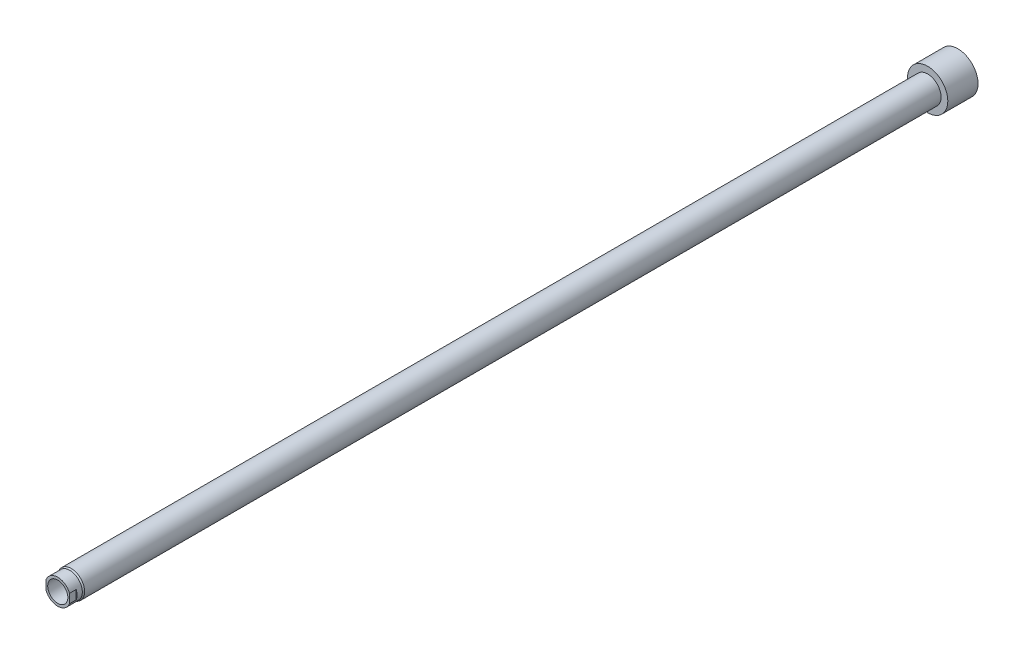
from build123d import *

# Parameters (mm, degrees)
SKETCH1_W           = 19.05
SKETCH1_H           = 28.575
SKETCH2_R           = 12.7
BOSS_EXTRUDE1_DEPTH = 695.325
SKETCH3_R           = 12.7
BOSS_EXTRUDE2_DEPTH = 1.374815329
BOSS_EXTRUDE2_TAPER = 30
SKETCH4_R           = 11.90625
BOSS_EXTRUDE3_DEPTH = 11.325184671
CUT_EXTRUDE1_START  = -6.35
CUT_EXTRUDE1_DEPTH  = 6.35
CUT_EXTRUDE2_START  = -6.35
CUT_EXTRUDE2_DEPTH  = 6.35
SKETCH10_R          = 9.525
CUT_EXTRUDE4_DEPTH  = 28.575
SKETCH8_R           = 19.05
BOSS_EXTRUDE5_DEPTH = 114.3
SKETCH9_R           = 19.05
SKETCH9_R_2         = 12.7
CUT_EXTRUDE3_DEPTH  = 114.3


with BuildPart() as part:
    # Sketch1 → Revolve1 (revolve)
    with BuildSketch(Plane.XZ, mode=Mode.PRIVATE) as revolve1_sk:
        with Locations((9.525, -671.5125)):
            Rectangle(SKETCH1_W, SKETCH1_H)
    revolve(revolve1_sk.sketch.rotate(Axis((0, 0, -657.225), (0, 0, -1)), 180), axis=Axis((0, 0, -657.225), (0, 0, -1)))

    # Sketch2 → Boss-Extrude1 (add)
    with BuildSketch(Plane.XY.offset(-657.225)):
        Circle(SKETCH2_R)
    extrude(amount=BOSS_EXTRUDE1_DEPTH)

    # Sketch3 → Boss-Extrude2 (add)
    with BuildSketch(Plane.XY.offset(38.1)):
        Circle(SKETCH3_R)
    extrude(amount=BOSS_EXTRUDE2_DEPTH, taper=BOSS_EXTRUDE2_TAPER)

    # Sketch4 → Boss-Extrude3 (add)
    with BuildSketch(Plane.XY.offset(39.474815329)):
        Circle(SKETCH4_R)
    extrude(amount=BOSS_EXTRUDE3_DEPTH)

    # Sketch5 → Cut-Extrude1 (cut)
    with BuildSketch(Plane.XY.offset(50.8).offset(CUT_EXTRUDE1_START)):
        with BuildLine():
            Line((11.1125, 4.274474566), (11.1125, -4.274474566))
            ThreePointArc((11.1125, -4.274474566), (11.90625, 0), (11.1125, 4.274474566))
        make_face()
    extrude(amount=CUT_EXTRUDE1_DEPTH, mode=Mode.SUBTRACT)

    # Sketch6 → Cut-Extrude2 (cut)
    with BuildSketch(Plane.XY.offset(50.8).offset(CUT_EXTRUDE2_START)):
        with BuildLine():
            Line((-11.1125, -4.274474566), (-11.1125, 4.274474566))
            ThreePointArc((-11.1125, 4.274474566), (-11.90625, 0), (-11.1125, -4.274474566))
        make_face()
    extrude(amount=CUT_EXTRUDE2_DEPTH, mode=Mode.SUBTRACT)

    # Sketch10 → Cut-Extrude4 (cut)
    with BuildSketch(Plane.XY.offset(50.8)):
        Circle(SKETCH10_R)
    extrude(amount=-CUT_EXTRUDE4_DEPTH, mode=Mode.SUBTRACT)

    # Sketch8 → Boss-Extrude5 (add)
    with BuildSketch(Plane(origin=(0, 0, -685.8), x_dir=(-1, 0, 0), z_dir=(0, 0, -1))):
        Circle(SKETCH8_R)
    extrude(amount=BOSS_EXTRUDE5_DEPTH)

    # Sketch9 → Cut-Extrude3 (cut)
    with BuildSketch(Plane.XY.offset(-657.225)):
        with Locations(Location((0, 0, 0), (0, 0, 180))):
            Circle(SKETCH9_R)
        Circle(SKETCH9_R_2, mode=Mode.SUBTRACT)
    extrude(amount=-CUT_EXTRUDE3_DEPTH, mode=Mode.SUBTRACT)


solid = part.part
